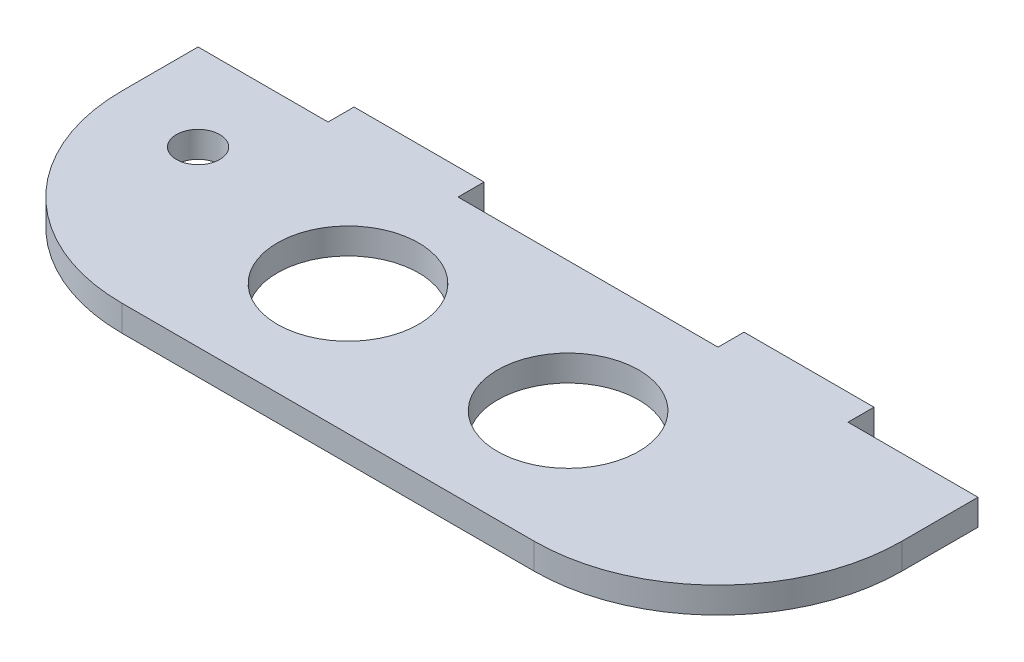
from build123d import *

# Parameters (mm, degrees)
BOSS_EXTRUDE1_DEPTH = 3
SKETCH2_R           = 8.15
CUT_EXTRUDE4_DEPTH  = 49.559242169
SKETCH3_R           = 2.5
CUT_EXTRUDE5_DEPTH  = 10
CUT_EXTRUDE6_DEPTH  = 10


with BuildPart() as part:
    # Sketch1 → Boss-Extrude1 (new body)
    with BuildSketch(Plane(origin=(0, 0, 0), x_dir=(1, 0, 0), z_dir=(0, 1, 0))):
        Polygon((-45, 15), (-30, 15), (-30, 18), (-15, 18), (-15, 15), (15, 15), (15, 18), (30, 18), (30, 15), (45, 15), (45, -15), (-45, -15), align=None)
    extrude(amount=BOSS_EXTRUDE1_DEPTH)

    # Sketch2 → Cut-Extrude4 (cut, through all)
    with BuildSketch(Plane(origin=(0, 0, 0), x_dir=(1, 0, 0), z_dir=(0, 1, 0))):
        with Locations(Location((-12.7, 0, 0), (0, 0, 270))):
            Circle(SKETCH2_R)
        with Locations(Location((12.7, 0, 0), (0, 0, 90))):
            Circle(SKETCH2_R)
    extrude(amount=CUT_EXTRUDE4_DEPTH, mode=Mode.SUBTRACT)

    # Sketch3 → Cut-Extrude5 (cut)
    with BuildSketch(Plane(origin=(0, 3, 0), x_dir=(1, 0, 0), z_dir=(0, 1, 0))):
        with Locations(Location((-35, 5, 0), (0, 0, 270))):
            Circle(SKETCH3_R)
    extrude(amount=-CUT_EXTRUDE5_DEPTH, mode=Mode.SUBTRACT)

    # Sketch4 → Cut-Extrude6 (cut)
    with BuildSketch(Plane(origin=(0, 3, 0), x_dir=(1, 0, 0), z_dir=(0, 1, 0))):
        with BuildLine():
            ThreePointArc((-23.786796564, -15), (-38.786796564, -8.786796564), (-45, 6.213203436))
            Line((-45, 6.213203436), (-45, -15))
            Line((-45, -15), (-23.786796564, -15))
        make_face()
        with BuildLine():
            ThreePointArc((45, 6.213203436), (38.786796564, -8.786796564), (23.786796564, -15))
            Line((23.786796564, -15), (45, -15))
            Line((45, -15), (45, 6.213203436))
        make_face()
    extrude(amount=-CUT_EXTRUDE6_DEPTH, mode=Mode.SUBTRACT)


solid = part.part
